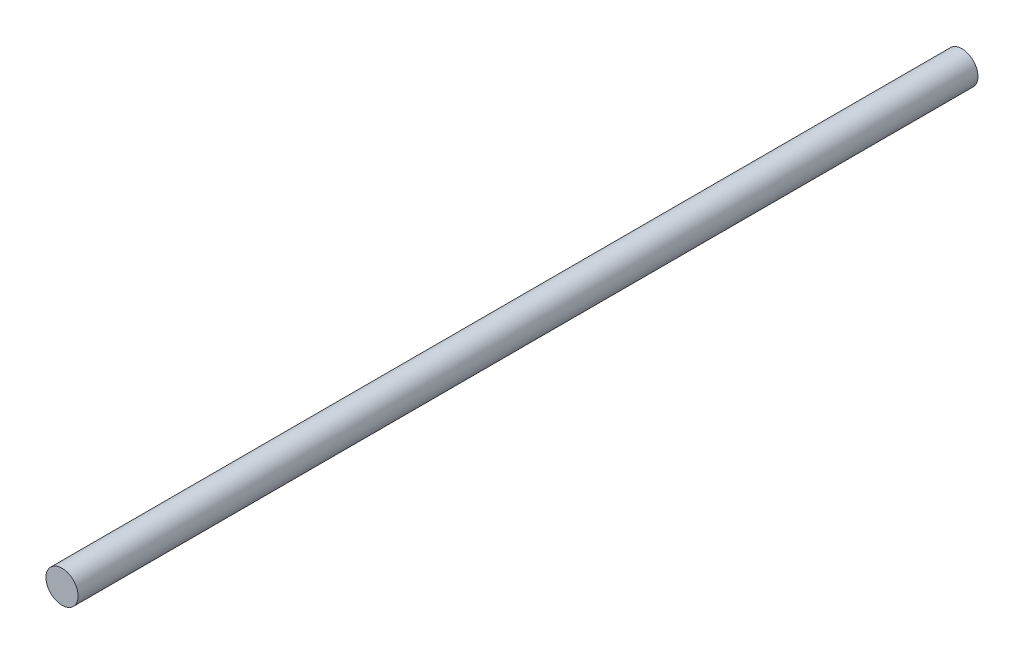
from build123d import *

# Parameters (mm, degrees)
SKETCH_1_R      = 2.5
EXTRUDE_1_DEPTH = 140


with BuildPart() as part:
    # 草圖1 → 填料-伸長1 (new body)
    with BuildSketch(Plane.XY):
        Circle(SKETCH_1_R)
    extrude(amount=EXTRUDE_1_DEPTH)


solid = part.part
